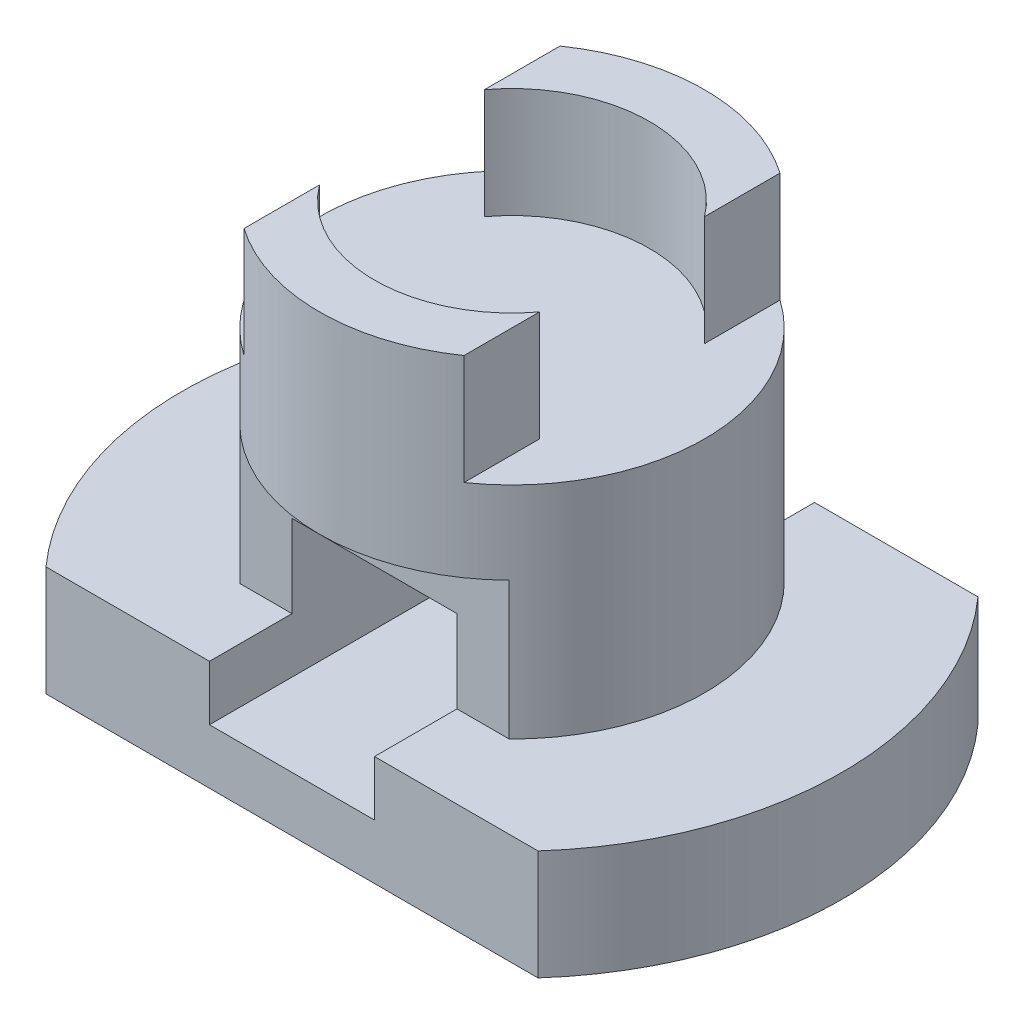
from build123d import *

# Parameters (mm, degrees)
BOSS_EXTRUDE1_DEPTH = 20
SKETCH2_R           = 35
BOSS_EXTRUDE2_DEPTH = 40
SKETCH3_W           = 30
SKETCH3_H           = 25
CUT_EXTRUDE1_DEPTH  = 128
SKETCH4_W           = 89.4427191
SKETCH4_H           = 25
CUT_EXTRUDE2_DEPTH  = 15
BOSS_EXTRUDE3_DEPTH = 20


with BuildPart() as part:
    # Sketch1 → Boss-Extrude1 (new body)
    with BuildSketch(Plane(origin=(0, 0, 0), x_dir=(1, 0, 0), z_dir=(0, 1, 0))):
        with BuildLine():
            Line((-44.72135955, -40), (44.72135955, -40))
            ThreePointArc((44.72135955, -40), (60, 0), (44.72135955, 40))
            Line((44.72135955, 40), (-44.72135955, 40))
            ThreePointArc((-44.72135955, 40), (-60, 0), (-44.72135955, -40))
        make_face()
    extrude(amount=BOSS_EXTRUDE1_DEPTH)

    # Sketch2 → Boss-Extrude2 (add)
    with BuildSketch(Plane(origin=(0, 20, 0), x_dir=(1, 0, 0), z_dir=(0, 1, 0))):
        with Locations(Location((0, 0, 0), (0, 0, 270))):
            Circle(SKETCH2_R)
    extrude(amount=BOSS_EXTRUDE2_DEPTH)

    # Sketch3 → Cut-Extrude1 (cut)
    with BuildSketch(Plane.XY.offset(40)):
        with Locations((0, 22.5)):
            Rectangle(SKETCH3_W, SKETCH3_H)
    extrude(amount=-CUT_EXTRUDE1_DEPTH, mode=Mode.SUBTRACT)

    # Sketch4 → Cut-Extrude2 (cut)
    with BuildSketch(Plane.XY.offset(40)):
        with Locations((0, 32.5)):
            Rectangle(SKETCH4_W, SKETCH4_H)
    cut_extrude2 = extrude(amount=-CUT_EXTRUDE2_DEPTH, mode=Mode.SUBTRACT)

    # Mirror1: Cut-Extrude2 across plane
    add(cut_extrude2.mirror(Plane.XY), mode=Mode.SUBTRACT)

    # Sketch6 → Boss-Extrude3 (add)
    with BuildSketch(Plane(origin=(0, 60, 0), x_dir=(1, 0, 0), z_dir=(0, 1, 0))):
        with BuildLine():
            ThreePointArc((20, 28.722813233), (0, 35), (-20, 28.722813233))
            Line((-20, 28.722813233), (-20, 15))
            ThreePointArc((-20, 15), (0, 25), (20, 15))
            Line((20, 15), (20, 28.722813233))
        make_face()
        with BuildLine():
            Line((-20, -15), (-20, -28.722813233))
            ThreePointArc((-20, -28.722813233), (0, -35), (20, -28.722813233))
            Line((20, -28.722813233), (20, -15))
            ThreePointArc((20, -15), (0, -25), (-20, -15))
        make_face()
    extrude(amount=BOSS_EXTRUDE3_DEPTH)


solid = part.part
